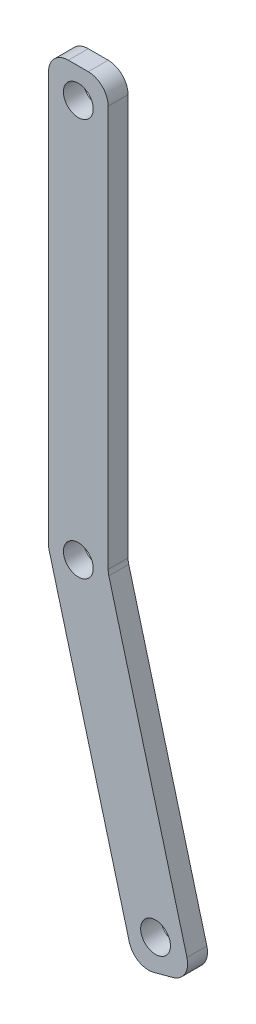
from build123d import *

# Parameters (mm, degrees)
ESQUISSE2_R        = 1.5
BOSS_EXTRU_3_DEPTH = 2
CONG_3_R           = 2


with BuildPart() as part:
    # Esquisse2 → Boss.-Extru.3 (new body)
    with BuildSketch(Plane.XY):
        Polygon((-3, 23), (-3, -20.394957493), (5.64325101, -52.652009403), (11.438805967, -51.099095132), (3, -19.605042507), (3, 23), align=None)
        with Locations((7.764571353, -48.977774789)):
            Circle(ESQUISSE2_R, mode=Mode.SUBTRACT)
        with Locations((0, -20)):
            Circle(ESQUISSE2_R, mode=Mode.SUBTRACT)
        with Locations((0, 20)):
            Circle(ESQUISSE2_R, mode=Mode.SUBTRACT)
    extrude(amount=BOSS_EXTRU_3_DEPTH)

    # Congé3
    cong_3_edges = [part.edges().sort_by_distance(p)[0] for p in [
        (-3, -20.394957493, 1),
        (-3, 23, 1),
        (3, 23, 1),
        (3, -19.605042507, 1),
        (11.438805967, -51.099095132, 1),
        (5.64325101, -52.652009403, 1),
    ]]
    fillet(cong_3_edges, radius=CONG_3_R)


solid = part.part
